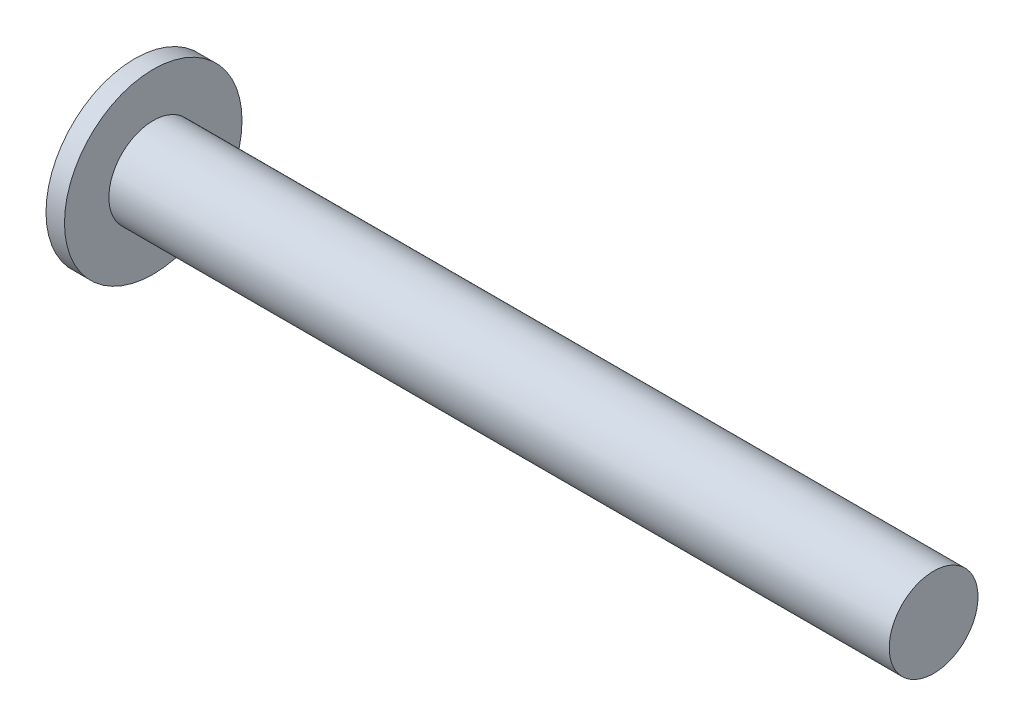
from build123d import *

# Parameters (mm, degrees)
SKETCH_1_R      = 12
EXTRUDE_1_DEPTH = 2.5
SKETCH_2_R      = 6
EXTRUDE_2_DEPTH = 105.5


with BuildPart() as part:
    # Эскиз1 → Бобышка-Вытянуть1 (new body)
    with BuildSketch(Plane(origin=(0, 0, 0), x_dir=(0, 0, -1), z_dir=(1, 0, 0))):
        Circle(SKETCH_1_R)
    extrude(amount=EXTRUDE_1_DEPTH)

    # Эскиз2 → Бобышка-Вытянуть2 (add)
    with BuildSketch(Plane(origin=(2.5, 0, 0), x_dir=(0, 0, -1), z_dir=(1, 0, 0))):
        Circle(SKETCH_2_R)
    extrude(amount=EXTRUDE_2_DEPTH)


solid = part.part
